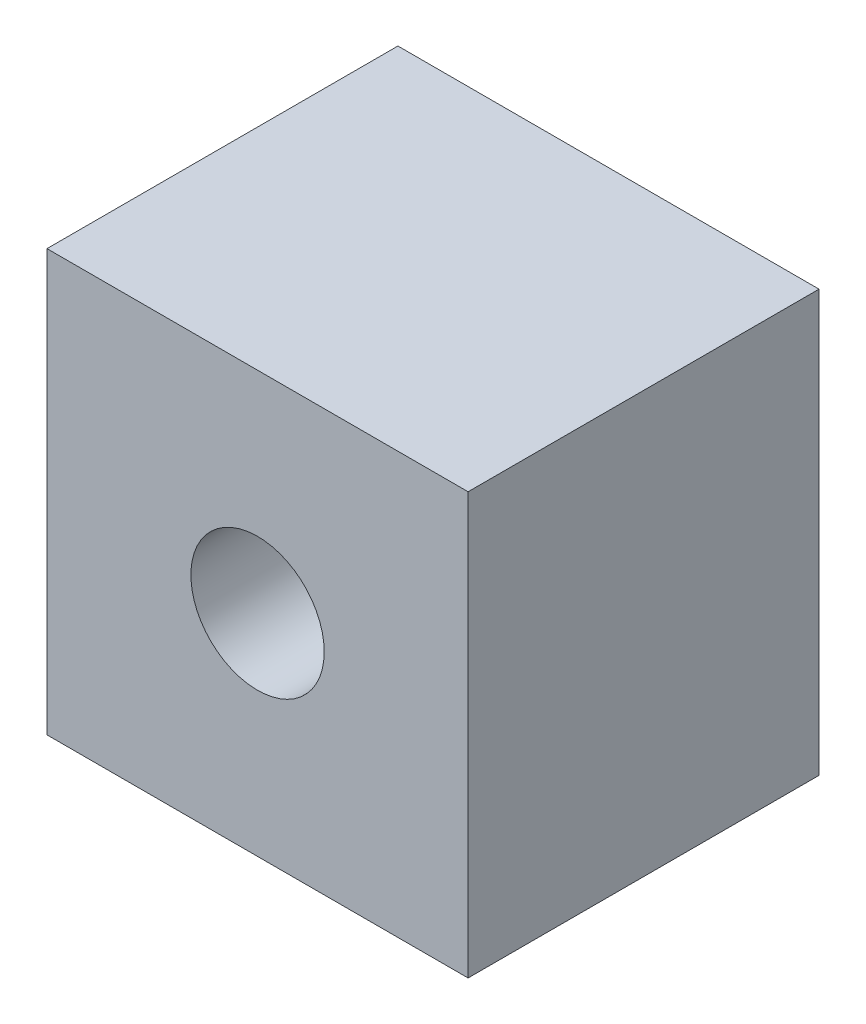
from build123d import *

# Parameters (mm, degrees)
SKETCH_1_W      = 12
SKETCH_1_H      = 12
SKETCH_1_R      = 1.9
EXTRUDE_1_DEPTH = 10


with BuildPart() as part:
    # 스케치1 → 보스-돌출1 (new body)
    with BuildSketch(Plane.XY):
        Rectangle(SKETCH_1_W, SKETCH_1_H)
        Circle(SKETCH_1_R, mode=Mode.SUBTRACT)
    extrude(amount=EXTRUDE_1_DEPTH)


solid = part.part
